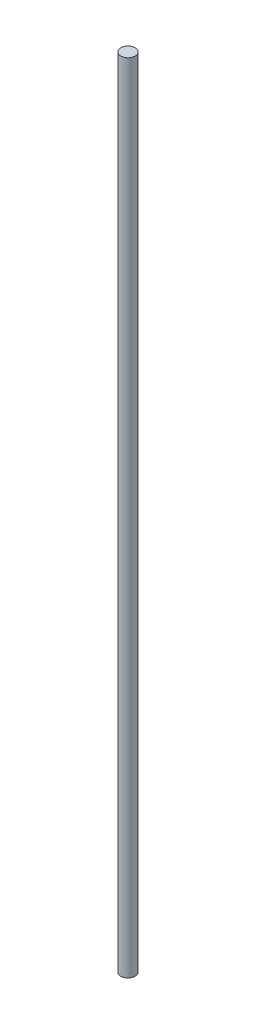
from build123d import *

# Parameters (mm, degrees)
SKETCH1_R           = 4
BOSS_EXTRUDE1_DEPTH = 221


with BuildPart() as part:
    # Sketch1 → Boss-Extrude1 (new, symmetric)
    with BuildSketch(Plane(origin=(0, 0, 0), x_dir=(1, 0, 0), z_dir=(0, 1, 0))):
        with Locations(Location((0, 0, 0), (0, 0, 270))):
            Circle(SKETCH1_R)
    extrude(amount=BOSS_EXTRUDE1_DEPTH, both=True)


solid = part.part
